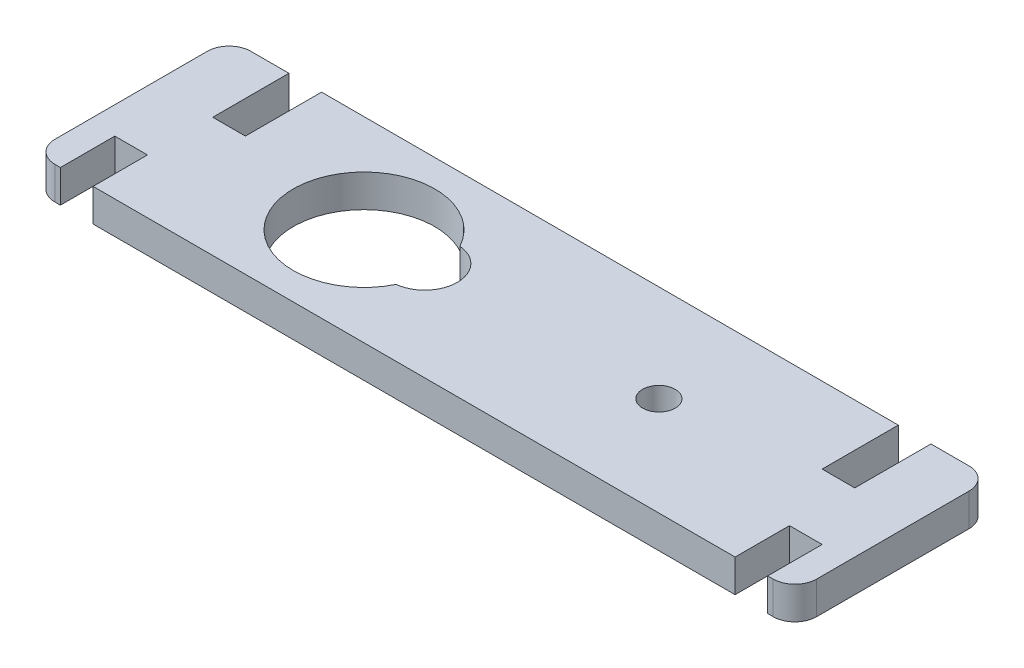
from build123d import *

# Parameters (mm, degrees)
BOSS_EXTRUDE1_DEPTH = 3
SKETCH4_R           = 6.5
CUT_EXTRUDE1_DEPTH  = 3
SKETCH5_R           = 3
SKETCH5_R_2         = 1.5
CUT_EXTRUDE2_DEPTH  = 3
SKETCH6_W           = 3
SKETCH6_H           = 7
CUT_EXTRUDE3_DEPTH  = 3
SKETCH7_W           = 3
SKETCH7_H           = 5
CUT_EXTRUDE4_DEPTH  = 3


with BuildPart() as part:
    # Sketch2 → Boss-Extrude1 (new body)
    with BuildSketch(Plane(origin=(0, 0, 0), x_dir=(1, 0, 0), z_dir=(0, 1, 0))):
        with BuildLine():
            Line((-3.583885407, 15.877073113), (62.416114593, 15.877073113))
            ThreePointArc((62.416114593, 15.877073113), (63.830328155, 15.291286675), (64.416114593, 13.877073113))
            Line((64.416114593, 13.877073113), (64.416114593, -0.122926887))
            ThreePointArc((64.416114593, -0.122926887), (63.830328155, -1.53714045), (62.416114593, -2.122926887))
            Line((62.416114593, -2.122926887), (-3.583885407, -2.122926887))
            ThreePointArc((-3.583885407, -2.122926887), (-4.99809897, -1.53714045), (-5.583885407, -0.122926887))
            Line((-5.583885407, -0.122926887), (-5.583885407, 13.877073113))
            ThreePointArc((-5.583885407, 13.877073113), (-4.99809897, 15.291286675), (-3.583885407, 15.877073113))
        make_face()
    extrude(amount=BOSS_EXTRUDE1_DEPTH)

    # Sketch4 → Cut-Extrude1 (cut)
    with BuildSketch(Plane(origin=(0, 3, 0), x_dir=(1, 0, 0), z_dir=(0, 1, 0))):
        with Locations(Location((15.816114593, 6.877073113, 0), (0, 0, 270))):
            Circle(SKETCH4_R)
    extrude(amount=-CUT_EXTRUDE1_DEPTH, mode=Mode.SUBTRACT)

    # Sketch5 → Cut-Extrude2 (cut)
    with BuildSketch(Plane(origin=(0, 3, 0), x_dir=(1, 0, 0), z_dir=(0, 1, 0))):
        with Locations((21.296114593, 6.977073113)):
            Circle(SKETCH5_R)
        with Locations(Location((42.816114593, 6.977073113, 0), (0, 0, 270))):
            Circle(SKETCH5_R_2)
    extrude(amount=-CUT_EXTRUDE2_DEPTH, mode=Mode.SUBTRACT)

    # Sketch6 → Cut-Extrude3 (cut)
    with BuildSketch(Plane(origin=(0, 3, 0), x_dir=(1, 0, 0), z_dir=(0, 1, 0))):
        with Locations((1.416114593, 12.377073113)):
            Rectangle(SKETCH6_W, SKETCH6_H)
        with Locations((57.416114593, 12.377073113)):
            Rectangle(SKETCH6_W, SKETCH6_H)
    extrude(amount=-CUT_EXTRUDE3_DEPTH, mode=Mode.SUBTRACT)

    # Sketch7 → Cut-Extrude4 (cut)
    with BuildSketch(Plane(origin=(0, 3, 0), x_dir=(1, 0, 0), z_dir=(0, 1, 0))):
        with Locations((60.416114593, 0.377073113)):
            Rectangle(SKETCH7_W, SKETCH7_H)
        with Locations((-1.583885407, 0.377073113)):
            Rectangle(SKETCH7_W, SKETCH7_H)
    extrude(amount=-CUT_EXTRUDE4_DEPTH, mode=Mode.SUBTRACT)


solid = part.part
